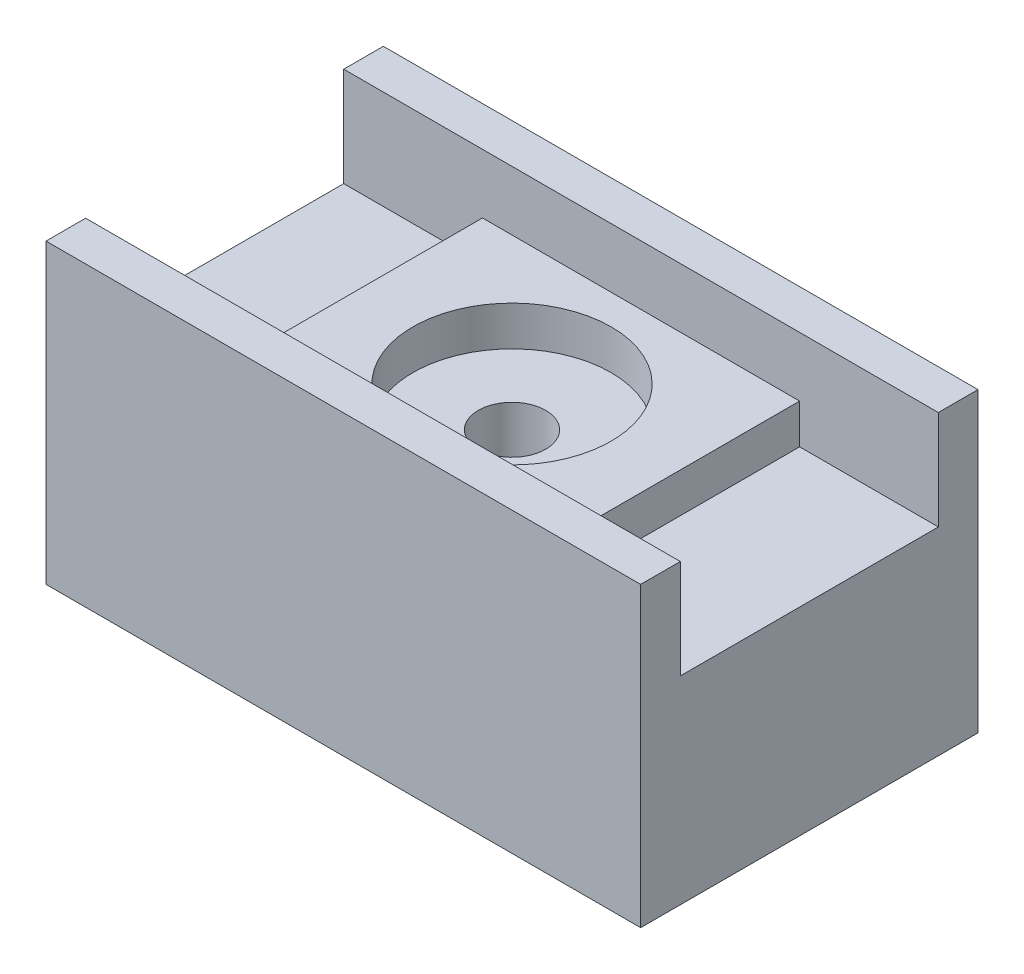
from build123d import *

# Parameters (mm, degrees)
SKETCH1_W           = 16
SKETCH1_H           = 13.02
SKETCH1_W_2         = 7
BOSS_EXTRUDE1_DEPTH = 10
SKETCH1_3_W         = 16
SKETCH1_3_H         = 13.02
BOSS_EXTRUDE2_DEPTH = 2
BOSS_EXTRUDE3_DEPTH = 5
SKETCH2_R           = 1.7
CUT_EXTRUDE1_DEPTH  = 22.01
SKETCH2_3_R         = 5
SKETCH2_3_R_2       = 1.7
CUT_EXTRUDE2_DEPTH  = 2


with BuildPart() as part:
    # Sketch1 → Boss-Extrude1 (new body)
    with BuildSketch(Plane(origin=(0, 0, 0), x_dir=(1, 0, 0), z_dir=(0, 1, 0))):
        Polygon((-15, -6.51), (-15, -8.51), (15, -8.51), (15, -6.51), (8, -6.51), (-8, -6.51), align=None)
        Rectangle(SKETCH1_W, SKETCH1_H)
        Polygon((-15, 8.51), (-15, 6.51), (-8, 6.51), (8, 6.51), (15, 6.51), (15, 8.51), align=None)
        with Locations((11.5, 0)):
            Rectangle(SKETCH1_W_2, SKETCH1_H)
        with Locations((-11.5, 0)):
            Rectangle(SKETCH1_W_2, SKETCH1_H)
    extrude(amount=-BOSS_EXTRUDE1_DEPTH)

    # Sketch1<3> → Boss-Extrude2 (add)
    with BuildSketch(Plane(origin=(0, 0, 0), x_dir=(1, 0, 0), z_dir=(0, 1, 0))):
        Rectangle(SKETCH1_3_W, SKETCH1_3_H)
    extrude(amount=BOSS_EXTRUDE2_DEPTH)

    # Sketch1<4> → Boss-Extrude3 (add)
    with BuildSketch(Plane(origin=(0, 0, 0), x_dir=(1, 0, 0), z_dir=(0, 1, 0))):
        Polygon((-15, -6.51), (-15, -8.51), (15, -8.51), (15, -6.51), (8, -6.51), (-8, -6.51), align=None)
        Polygon((-15, 8.51), (-15, 6.51), (-8, 6.51), (8, 6.51), (15, 6.51), (15, 8.51), align=None)
    extrude(amount=BOSS_EXTRUDE3_DEPTH)

    # Sketch2 → Cut-Extrude1 (cut, through all)
    with BuildSketch(Plane(origin=(0, 2, 0), x_dir=(1, 0, 0), z_dir=(0, 1, 0))):
        with Locations(Location((0, 0, 0), (0, 0, 270))):
            Circle(SKETCH2_R)
    extrude(amount=-CUT_EXTRUDE1_DEPTH, mode=Mode.SUBTRACT)

    # Sketch2<3> → Cut-Extrude2 (cut)
    with BuildSketch(Plane(origin=(0, 2, 0), x_dir=(1, 0, 0), z_dir=(0, 1, 0))):
        with Locations(Location((0, 0, 0), (0, 0, 270))):
            Circle(SKETCH2_3_R)
        with Locations(Location((0, 0, 0), (0, 0, 270))):
            Circle(SKETCH2_3_R_2, mode=Mode.SUBTRACT)
    extrude(amount=-CUT_EXTRUDE2_DEPTH, mode=Mode.SUBTRACT)


solid = part.part
